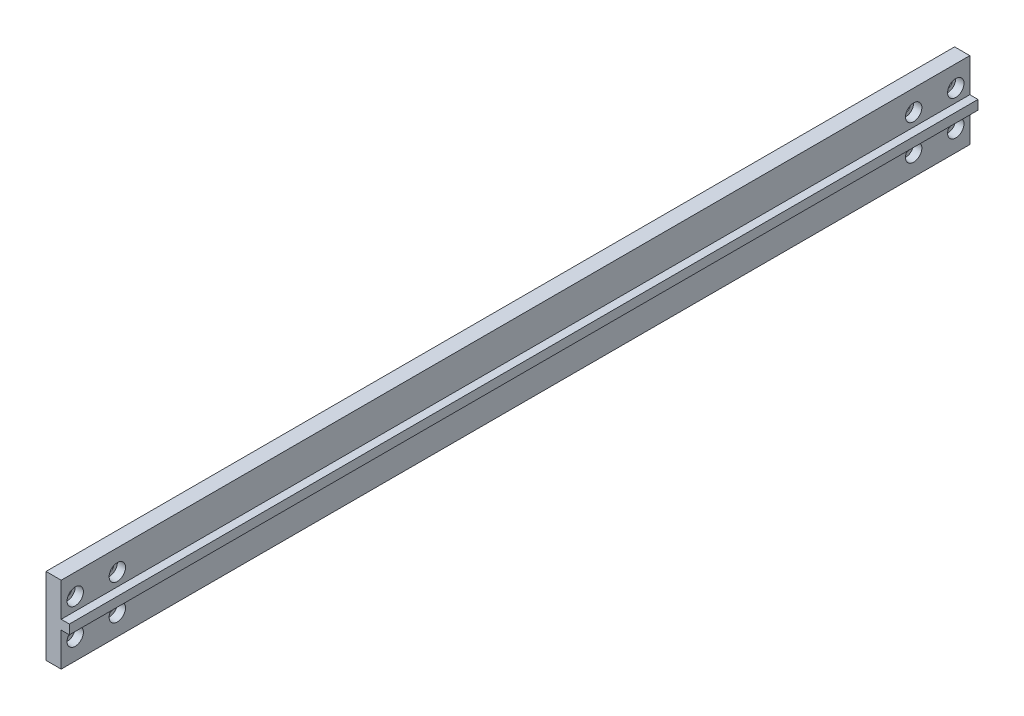
from build123d import *

# Parameters (mm, degrees)
EXTRUDE_1_DEPTH           = 388.6
HOLE_WIZARD_1_D           = 4
HOLE_WIZARD_1_CBORE_D     = 7
HOLE_WIZARD_1_CBORE_DEPTH = 3.5


with BuildPart() as part:
    # 草图1 → 凸台-拉伸1 (new body)
    with BuildSketch(Plane.XY):
        Polygon((0, 16.475), (0, -16.475), (6.5, -16.475), (6.5, -2), (10, -2), (10, 2), (6.5, 2), (6.5, 16.475), align=None)
    extrude(amount=EXTRUDE_1_DEPTH)

    # 打孔尺寸(%根据)内六角圆柱头螺钉的类型1 (through all)
    with Locations(Plane(origin=(6.5, 0, 0), x_dir=(0, 0, -1), z_dir=(1, 0, 0))):
        with Locations((-382.6, -7.5), (-364.6, -7.5), (-364.6, 7.5), (-382.6, 7.5), (-24, 7.5), (-24, -7.5), (-6, -7.5), (-6, 7.5)):
            CounterBoreHole(HOLE_WIZARD_1_D / 2, HOLE_WIZARD_1_CBORE_D / 2, HOLE_WIZARD_1_CBORE_DEPTH)


solid = part.part
